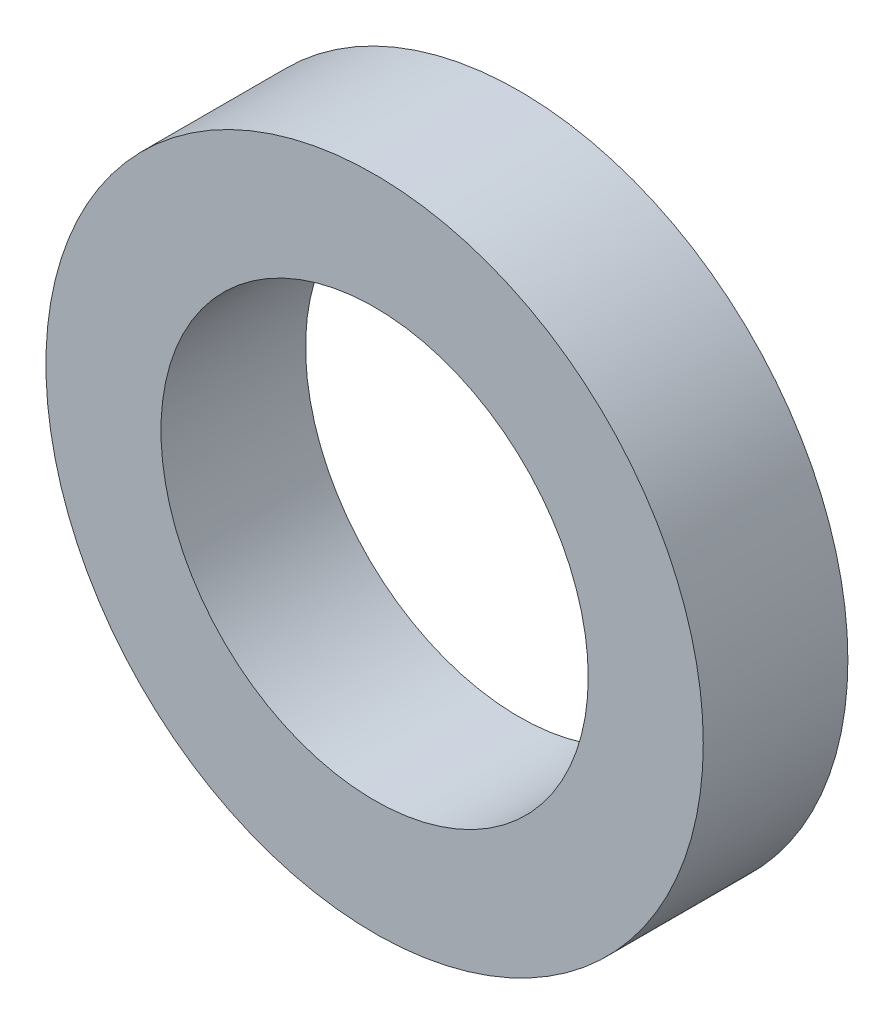
from build123d import *

# Parameters (mm, degrees)
SKETCH1_R           = 5
SKETCH1_R_2         = 3.25
BOSS_EXTRUDE1_DEPTH = 2.2


with BuildPart() as part:
    # Sketch1 → Boss-Extrude1 (new body)
    with BuildSketch(Plane.XY):
        Circle(SKETCH1_R)
        Circle(SKETCH1_R_2, mode=Mode.SUBTRACT)
    extrude(amount=BOSS_EXTRUDE1_DEPTH)


solid = part.part
